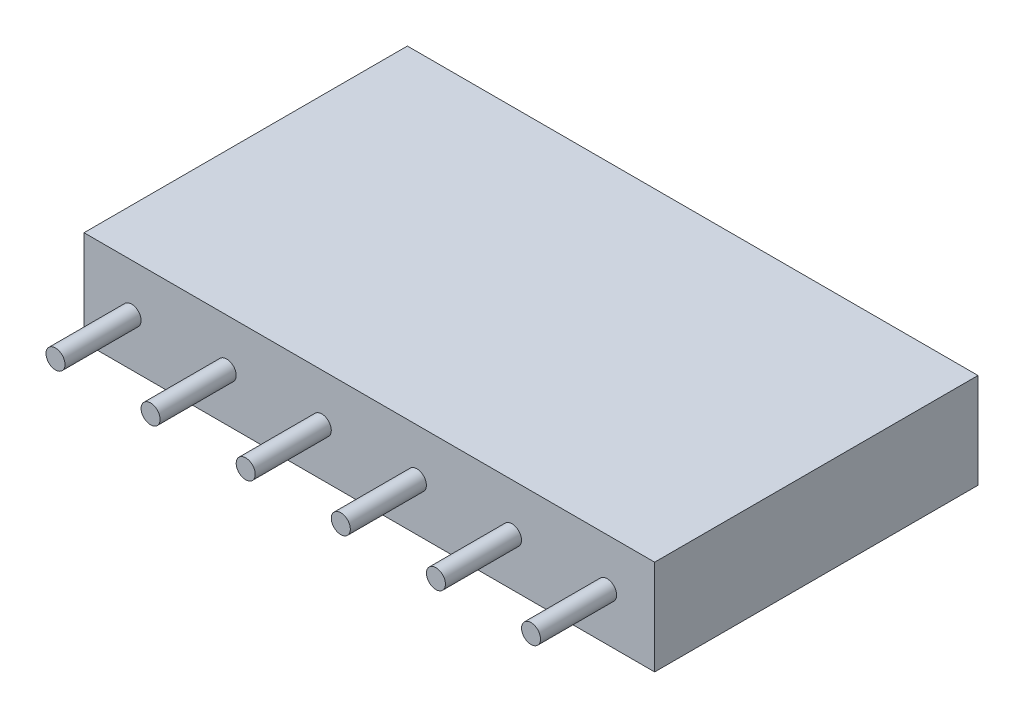
from build123d import *

# Parameters (mm, degrees)
ESQUISSE1_W                = 2.5
ESQUISSE1_H                = 2.5
BOSS_EXTRU_1_DEPTH         = 8.5
ESQUISSE2_R                = 0.25
BOSS_EXTRU_2_DEPTH         = 2
ESQUISSE3_R                = 0.25
ENL_V_MAT_EXTRU_2_DEPTH    = 4
R_P_TITION_LIN_AIRE1_COUNT = 6
R_P_TITION_LIN_AIRE1_PITCH = 2.5


with BuildPart() as part:
    # Esquisse1 → Boss.-Extru.1 (new body)
    with BuildSketch(Plane.XY):
        with Locations((-1.25, 1.25)):
            Rectangle(ESQUISSE1_W, ESQUISSE1_H)
    boss_extru_1 = extrude(amount=BOSS_EXTRU_1_DEPTH)

    # Esquisse2 → Boss.-Extru.2 (add)
    with BuildSketch(Plane.XY.offset(8.5)):
        with Locations((-1.25, 1.25)):
            Circle(ESQUISSE2_R)
    boss_extru_2 = extrude(amount=BOSS_EXTRU_2_DEPTH)

    # Esquisse3 → Enlèv. mat.-Extru.2 (cut)
    with BuildSketch(Plane(origin=(0, 0, 0), x_dir=(-1, 0, 0), z_dir=(0, 0, -1))):
        with Locations(Location((1.25, 1.25, 0), (0, 0, 180))):
            Circle(ESQUISSE3_R)
    enl_v_mat_extru_2 = extrude(amount=-ENL_V_MAT_EXTRU_2_DEPTH, mode=Mode.SUBTRACT)

    # Répétition linéaire1: Boss.-Extru.1, Boss.-Extru.2, Enlèv. mat.-Extru.2 ×6
    with Locations(*[(-i * R_P_TITION_LIN_AIRE1_PITCH, 0, 0) for i in range(1, R_P_TITION_LIN_AIRE1_COUNT)]):
        add(boss_extru_1)
        add(boss_extru_2)
        add(enl_v_mat_extru_2, mode=Mode.SUBTRACT)


solid = part.part
